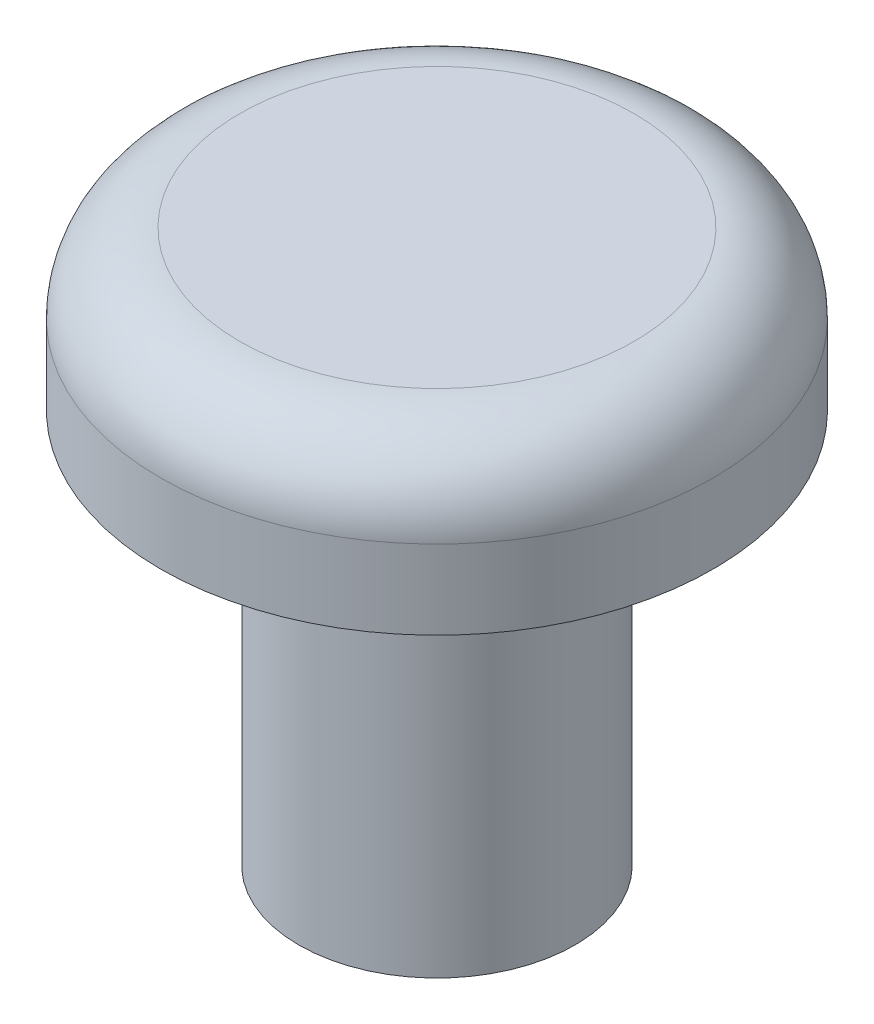
from build123d import *

# Parameters (mm, degrees)
ESQUISSE1_R        = 1.75
BOSS_EXTRU_1_DEPTH = 5
ESQUISSE2_R        = 3.5
BOSS_EXTRU_2_DEPTH = 2
CONG_1_R           = 1


with BuildPart() as part:
    # Esquisse1 → Boss.-Extru.1 (new body)
    with BuildSketch(Plane(origin=(0, 0, 0), x_dir=(1, 0, 0), z_dir=(0, 1, 0))):
        Circle(ESQUISSE1_R)
    extrude(amount=BOSS_EXTRU_1_DEPTH)

    # Esquisse2 → Boss.-Extru.2 (add)
    with BuildSketch(Plane(origin=(0, 5, 0), x_dir=(1, 0, 0), z_dir=(0, 1, 0))):
        Circle(ESQUISSE2_R)
    extrude(amount=BOSS_EXTRU_2_DEPTH)

    # Congé1
    cong_1_edges = [part.edges().sort_by_distance(p)[0] for p in [
        (-3.5, 7, 0),
    ]]
    fillet(cong_1_edges, radius=CONG_1_R)


solid = part.part
